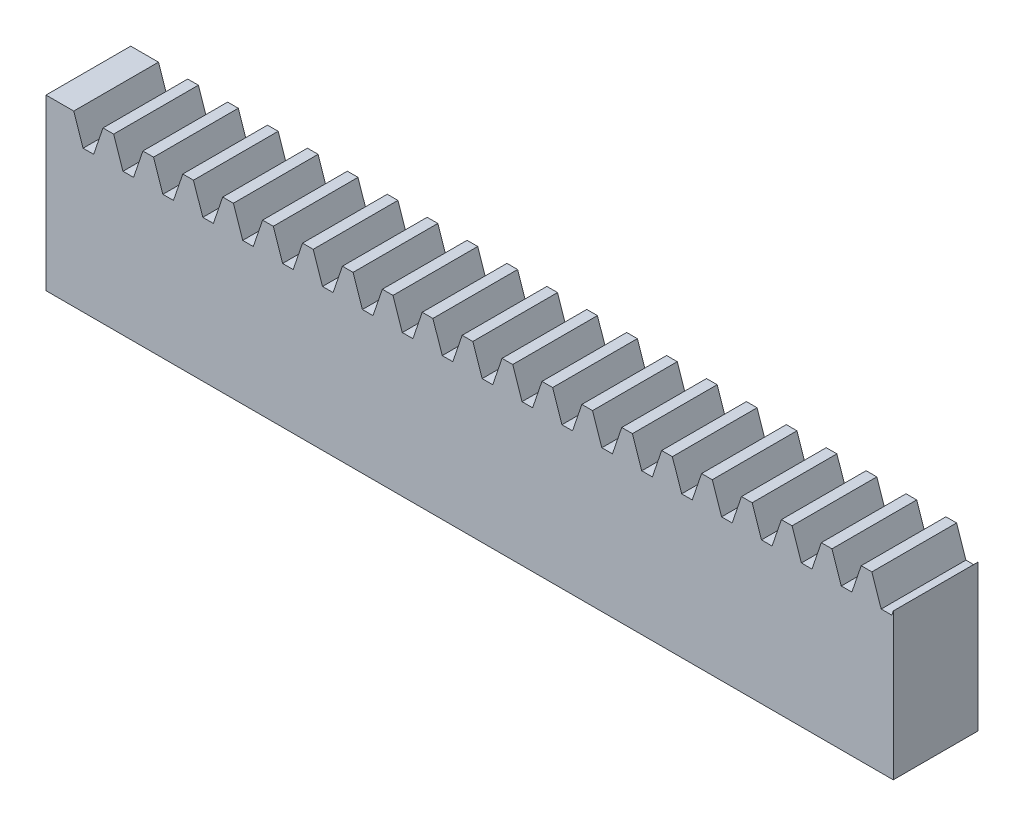
from build123d import *

# Parameters (mm, degrees)
CROQUIS1_W              = 100
CROQUIS1_H              = 20
SALIENTE_EXTRUIR1_DEPTH = 10
CORTAR_EXTRUIR1_DEPTH   = 52.961524227
MATRIZL1_COUNT          = 69
MATRIZL1_PITCH          = 4.71


with BuildPart() as part:
    # Croquis1 → Saliente-Extruir1 (new body)
    with BuildSketch(Plane.XY):
        Rectangle(CROQUIS1_W, CROQUIS1_H)
    extrude(amount=SALIENTE_EXTRUIR1_DEPTH)

    # Croquis2 → Cortar-Extruir1 (cut, through all)
    with BuildSketch(Plane.XY.offset(10)):
        Polygon((-43.275, 10), (-44.375, 6.75), (-45.625, 6.75), (-46.725, 10), align=None)
    cortar_extruir1 = extrude(amount=-CORTAR_EXTRUIR1_DEPTH, mode=Mode.SUBTRACT)

    # MatrizL1: Cortar-Extruir1 ×69
    with Locations(*[(i * MATRIZL1_PITCH, 0, 0) for i in range(1, MATRIZL1_COUNT)]):
        add(cortar_extruir1, mode=Mode.SUBTRACT)


solid = part.part
